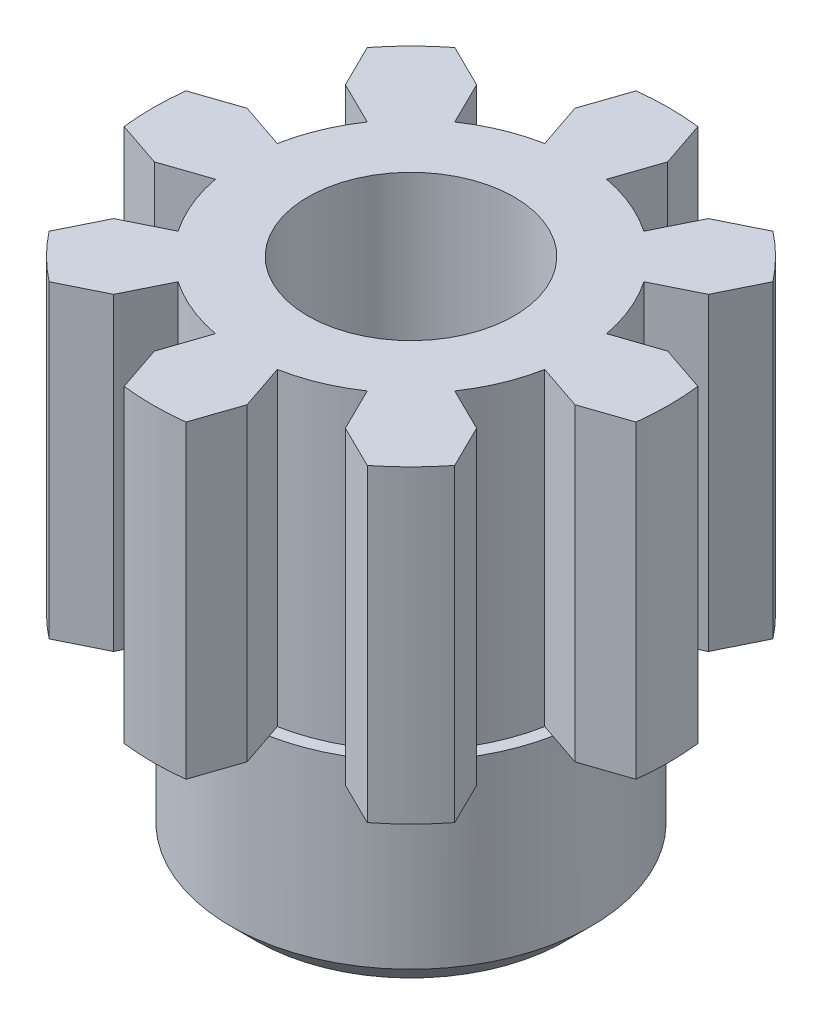
from build123d import *

# Parameters (mm, degrees)
CUT_EXTRUDE1_START = -3
CUT_EXTRUDE1_DEPTH = 3


with BuildPart() as part:
    # Sketch1 → Revolve1 (revolve)
    with BuildSketch(Plane.XY, mode=Mode.PRIVATE) as revolve1_sk:
        Polygon((1, 3), (2.5, 3), (2.5, 0), (1.75, 0), (1.75, -1.75), (1.5, -2), (1, -2), align=None)
    revolve(revolve1_sk.sketch.rotate(Axis((0, -2, 0), (0, 1, 0)), 90), axis=Axis((0, -2, 0), (0, 1, 0)))

    # Sketch2 → Cut-Extrude1 (cut)
    with BuildSketch(Plane(origin=(0, 3, 0), x_dir=(1, 0, 0), z_dir=(0, 1, 0)).offset(CUT_EXTRUDE1_START)):
        with BuildLine():
            Line((-0.3, 2.481934729), (-0.45, 2.039501177))
            Line((-0.45, 2.039501177), (-0.3, 1.597067625))
            ThreePointArc((-0.3, 1.597067625), (-0.621860578, 1.50130424), (-0.917165314, 1.341429382))
            Line((-0.917165314, 1.341429382), (-1.123947061, 1.760343164))
            Line((-1.123947061, 1.760343164), (-1.542860843, 1.967124912))
            ThreePointArc((-1.542860843, 1.967124912), (-0.956708581, 2.309698831), (-0.3, 2.481934729))
        make_face()
        with BuildLine():
            Line((0.45, 2.039501177), (0.3, 1.597067625))
            ThreePointArc((0.3, 1.597067625), (0.621860578, 1.50130424), (0.917165314, 1.341429382))
            Line((0.917165314, 1.341429382), (1.123947061, 1.760343164))
            Line((1.123947061, 1.760343164), (1.542860843, 1.967124912))
            ThreePointArc((1.542860843, 1.967124912), (0.956708581, 2.309698831), (0.3, 2.481934729))
            Line((0.3, 2.481934729), (0.45, 2.039501177))
        make_face()
        with BuildLine():
            Line((1.760343164, 1.123947061), (1.341429382, 0.917165314))
            ThreePointArc((1.341429382, 0.917165314), (1.50130424, 0.621860578), (1.597067625, 0.3))
            Line((1.597067625, 0.3), (2.039501177, 0.45))
            Line((2.039501177, 0.45), (2.481934729, 0.3))
            ThreePointArc((2.481934729, 0.3), (2.309698831, 0.956708581), (1.967124912, 1.542860843))
            Line((1.967124912, 1.542860843), (1.760343164, 1.123947061))
        make_face()
        with BuildLine():
            Line((2.039501177, -0.45), (1.597067625, -0.3))
            ThreePointArc((1.597067625, -0.3), (1.50130424, -0.621860578), (1.341429382, -0.917165314))
            Line((1.341429382, -0.917165314), (1.760343164, -1.123947061))
            Line((1.760343164, -1.123947061), (1.967124912, -1.542860843))
            ThreePointArc((1.967124912, -1.542860843), (2.309698831, -0.956708581), (2.481934729, -0.3))
            Line((2.481934729, -0.3), (2.039501177, -0.45))
        make_face()
        with BuildLine():
            Line((1.123947061, -1.760343164), (0.917165314, -1.341429382))
            ThreePointArc((0.917165314, -1.341429382), (0.621860578, -1.50130424), (0.3, -1.597067625))
            Line((0.3, -1.597067625), (0.45, -2.039501177))
            Line((0.45, -2.039501177), (0.3, -2.481934729))
            ThreePointArc((0.3, -2.481934729), (0.956708581, -2.309698831), (1.542860843, -1.967124912))
            Line((1.542860843, -1.967124912), (1.123947061, -1.760343164))
        make_face()
        with BuildLine():
            Line((-0.45, -2.039501177), (-0.3, -1.597067625))
            ThreePointArc((-0.3, -1.597067625), (-0.621860578, -1.50130424), (-0.917165314, -1.341429382))
            Line((-0.917165314, -1.341429382), (-1.123947061, -1.760343164))
            Line((-1.123947061, -1.760343164), (-1.542860843, -1.967124912))
            ThreePointArc((-1.542860843, -1.967124912), (-0.956708581, -2.309698831), (-0.3, -2.481934729))
            Line((-0.3, -2.481934729), (-0.45, -2.039501177))
        make_face()
        with BuildLine():
            Line((-1.760343164, -1.123947061), (-1.341429382, -0.917165314))
            ThreePointArc((-1.341429382, -0.917165314), (-1.50130424, -0.621860578), (-1.597067625, -0.3))
            Line((-1.597067625, -0.3), (-2.039501177, -0.45))
            Line((-2.039501177, -0.45), (-2.481934729, -0.3))
            ThreePointArc((-2.481934729, -0.3), (-2.309698831, -0.956708581), (-1.967124912, -1.542860843))
            Line((-1.967124912, -1.542860843), (-1.760343164, -1.123947061))
        make_face()
        with BuildLine():
            Line((-2.039501177, 0.45), (-1.597067625, 0.3))
            ThreePointArc((-1.597067625, 0.3), (-1.50130424, 0.621860578), (-1.341429382, 0.917165314))
            Line((-1.341429382, 0.917165314), (-1.760343164, 1.123947061))
            Line((-1.760343164, 1.123947061), (-1.967124912, 1.542860843))
            ThreePointArc((-1.967124912, 1.542860843), (-2.309698831, 0.956708581), (-2.481934729, 0.3))
            Line((-2.481934729, 0.3), (-2.039501177, 0.45))
        make_face()
    extrude(amount=CUT_EXTRUDE1_DEPTH, mode=Mode.SUBTRACT)


solid = part.part
